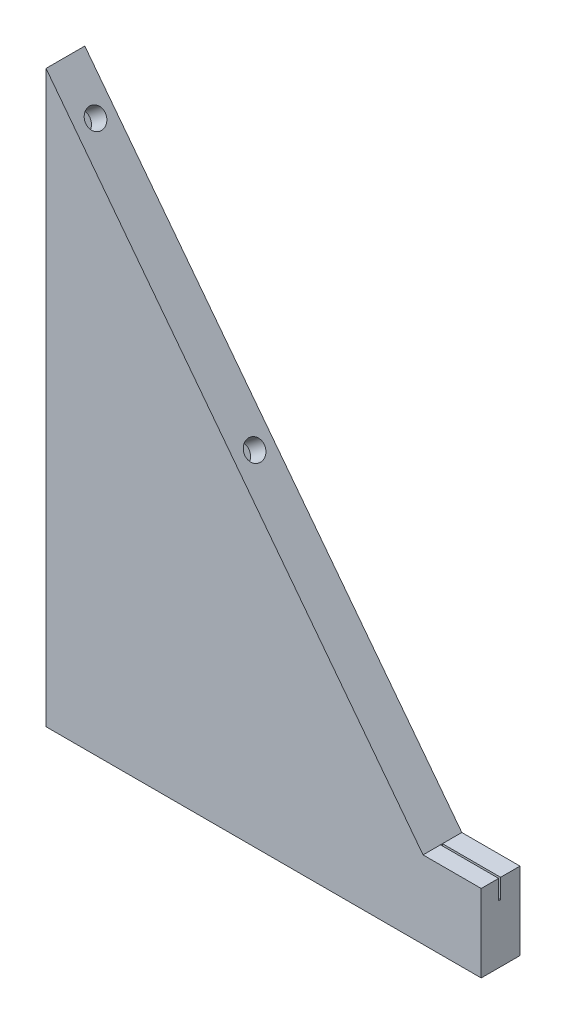
from build123d import *

# Parameters (mm, degrees)
EXTRUDE1_DEPTH = 12.7
SKETCH3_R      = 3.175
EXTRUDE2_DEPTH = 12.7
SKETCH4_R      = 3.175
EXTRUDE3_DEPTH = 6.35
SKETCH6_W      = 19.05
SKETCH6_H      = 0.635
EXTRUDE4_DEPTH = 6.35


with BuildPart() as part:
    # Sketch1 → Extrude1 (new body)
    with BuildSketch(Plane.XY):
        Polygon((-61.751637834, 93.380203425), (-61.751637834, -93.380203425), (61.751637834, -93.380203425), (80.801637834, -93.380203425), (80.801637834, -67.980203425), (61.751637834, -67.980203425), align=None)
    extrude(amount=EXTRUDE1_DEPTH)

    # Sketch3 → Extrude2 (cut)
    with BuildSketch(Plane.XZ.offset(93.380203425)):
        with Locations(Location((-53.500521912, 6.35, 0), (0, 0, 270))):
            Circle(SKETCH3_R)
        with Locations(Location((48.099478088, 6.35, 0), (0, 0, 270))):
            Circle(SKETCH3_R)
    extrude(amount=-EXTRUDE2_DEPTH, mode=Mode.SUBTRACT)

    # Sketch4 → Extrude3 (cut)
    with BuildSketch(Plane(origin=(6.12959486, 4.691516702, 0), x_dir=(0, 0, -1), z_dir=(0.7940964904073088, 0.6077917109691402, 0))):
        with Locations(Location((-6.128651302, 95.810025428, 0), (0, 0, 90))):
            Circle(SKETCH4_R)
        with Locations(Location((-6.128651302, 10.085025428, 0), (0, 0, 90))):
            Circle(SKETCH4_R)
    extrude(amount=-EXTRUDE3_DEPTH, mode=Mode.SUBTRACT)

    # Sketch6 → Extrude4 (cut)
    with BuildSketch(Plane(origin=(0, -67.980203425, 0), x_dir=(1, 0, 0), z_dir=(0, 1, 0))):
        with Locations((71.276637834, -6.6675)):
            Rectangle(SKETCH6_W, SKETCH6_H)
    extrude(amount=-EXTRUDE4_DEPTH, mode=Mode.SUBTRACT)


solid = part.part
